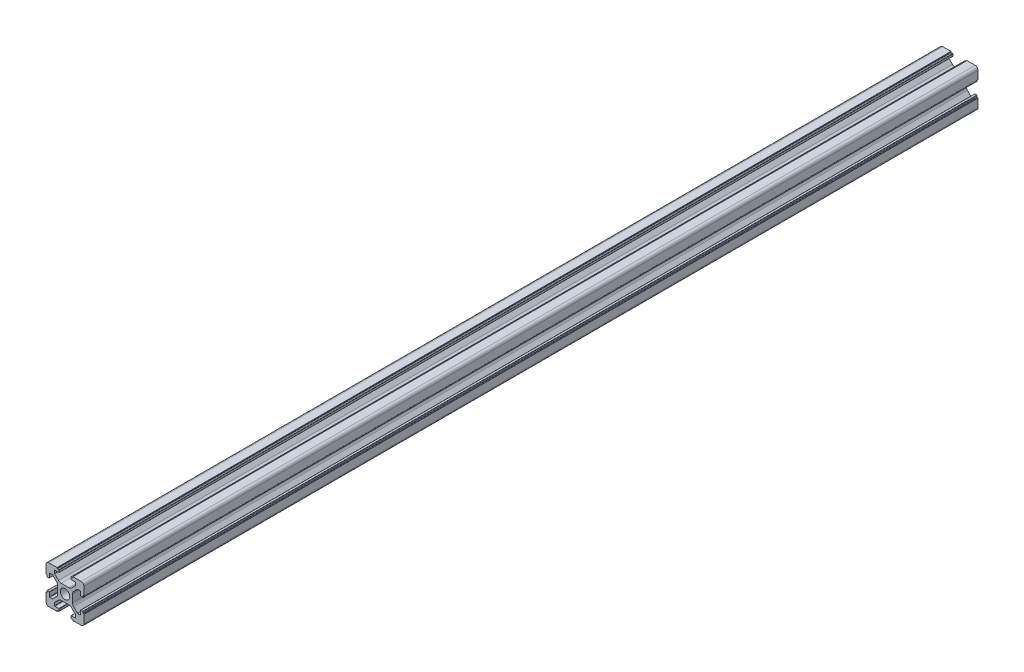
from build123d import *

# Parameters (mm, degrees)
SKETCH1_R           = 2.5
BOSS_EXTRUDE1_DEPTH = 470


with BuildPart() as part:
    # Sketch1 → Boss-Extrude1 (new body)
    with BuildSketch(Plane(origin=(0, 0, 0), x_dir=(1, 0, 0), z_dir=(0, 0, -1))):
        with BuildLine():
            Line((1.5, 0), (5.8, 0))
            ThreePointArc((5.8, 0), (5.870710678, 0.029289322), (5.9, 0.1))
            Line((5.9, 0.1), (5.9, 0.3))
            ThreePointArc((5.9, 0.3), (5.958578644, 0.441421356), (6.1, 0.5))
            Line((6.1, 0.5), (6.7, 0.5))
            ThreePointArc((6.7, 0.5), (6.841421356, 0.558578644), (6.9, 0.7))
            Line((6.9, 0.7), (6.9, 1.6))
            ThreePointArc((6.9, 1.6), (6.841421356, 1.741421356), (6.7, 1.8))
            Line((6.7, 1.8), (4.7, 1.8))
            ThreePointArc((4.7, 1.8), (4.558578644, 1.858578644), (4.5, 2))
            Line((4.5, 2), (4.5, 3.31507576))
            ThreePointArc((4.5, 3.31507576), (4.52283614, 3.429880789), (4.587867966, 3.527207794))
            Line((4.587867966, 3.527207794), (6.574873734, 5.514213562))
            ThreePointArc((6.574873734, 5.514213562), (7.223720432, 5.947759065), (7.989087297, 6.1))
            Line((7.989087297, 6.1), (12.010912703, 6.1))
            ThreePointArc((12.010912703, 6.1), (12.776279568, 5.947759065), (13.425126266, 5.514213562))
            Line((13.425126266, 5.514213562), (15.412132034, 3.527207794))
            ThreePointArc((15.412132034, 3.527207794), (15.47716386, 3.429880789), (15.5, 3.31507576))
            Line((15.5, 3.31507576), (15.5, 2))
            ThreePointArc((15.5, 2), (15.441421356, 1.858578644), (15.3, 1.8))
            Line((15.3, 1.8), (13.3, 1.8))
            ThreePointArc((13.3, 1.8), (13.158578644, 1.741421356), (13.1, 1.6))
            Line((13.1, 1.6), (13.1, 0.7))
            ThreePointArc((13.1, 0.7), (13.158578644, 0.558578644), (13.3, 0.5))
            Line((13.3, 0.5), (13.9, 0.5))
            ThreePointArc((13.9, 0.5), (14.041421356, 0.441421356), (14.1, 0.3))
            Line((14.1, 0.3), (14.1, 0.1))
            ThreePointArc((14.1, 0.1), (14.129289322, 0.029289322), (14.2, 0))
            Line((14.2, 0), (18.5, 0))
            ThreePointArc((18.5, 0), (19.560660172, 0.439339828), (20, 1.5))
            Line((20, 1.5), (20, 5.8))
            ThreePointArc((20, 5.8), (19.970710678, 5.870710678), (19.9, 5.9))
            Line((19.9, 5.9), (19.7, 5.9))
            ThreePointArc((19.7, 5.9), (19.558578644, 5.958578644), (19.5, 6.1))
            Line((19.5, 6.1), (19.5, 6.7))
            ThreePointArc((19.5, 6.7), (19.441421356, 6.841421356), (19.3, 6.9))
            Line((19.3, 6.9), (18.4, 6.9))
            ThreePointArc((18.4, 6.9), (18.258578644, 6.841421356), (18.2, 6.7))
            Line((18.2, 6.7), (18.2, 4.7))
            ThreePointArc((18.2, 4.7), (18.141421356, 4.558578644), (18, 4.5))
            Line((18, 4.5), (16.68492424, 4.5))
            ThreePointArc((16.68492424, 4.5), (16.570119211, 4.52283614), (16.472792206, 4.587867966))
            Line((16.472792206, 4.587867966), (14.485786438, 6.574873734))
            ThreePointArc((14.485786438, 6.574873734), (14.052240935, 7.223720432), (13.9, 7.989087297))
            Line((13.9, 7.989087297), (13.9, 12.010912703))
            ThreePointArc((13.9, 12.010912703), (14.052240935, 12.776279568), (14.485786438, 13.425126266))
            Line((14.485786438, 13.425126266), (16.472792206, 15.412132034))
            ThreePointArc((16.472792206, 15.412132034), (16.570119211, 15.47716386), (16.68492424, 15.5))
            Line((16.68492424, 15.5), (18, 15.5))
            ThreePointArc((18, 15.5), (18.141421356, 15.441421356), (18.2, 15.3))
            Line((18.2, 15.3), (18.2, 13.3))
            ThreePointArc((18.2, 13.3), (18.258578644, 13.158578644), (18.4, 13.1))
            Line((18.4, 13.1), (19.3, 13.1))
            ThreePointArc((19.3, 13.1), (19.441421356, 13.158578644), (19.5, 13.3))
            Line((19.5, 13.3), (19.5, 13.9))
            ThreePointArc((19.5, 13.9), (19.558578644, 14.041421356), (19.7, 14.1))
            Line((19.7, 14.1), (19.9, 14.1))
            ThreePointArc((19.9, 14.1), (19.970710678, 14.129289322), (20, 14.2))
            Line((20, 14.2), (20, 18.5))
            ThreePointArc((20, 18.5), (19.560660172, 19.560660172), (18.5, 20))
            Line((18.5, 20), (14.2, 20))
            ThreePointArc((14.2, 20), (14.129289322, 19.970710678), (14.1, 19.9))
            Line((14.1, 19.9), (14.1, 19.7))
            ThreePointArc((14.1, 19.7), (14.041421356, 19.558578644), (13.9, 19.5))
            Line((13.9, 19.5), (13.3, 19.5))
            ThreePointArc((13.3, 19.5), (13.158578644, 19.441421356), (13.1, 19.3))
            Line((13.1, 19.3), (13.1, 18.4))
            ThreePointArc((13.1, 18.4), (13.158578644, 18.258578644), (13.3, 18.2))
            Line((13.3, 18.2), (15.3, 18.2))
            ThreePointArc((15.3, 18.2), (15.441421356, 18.141421356), (15.5, 18))
            Line((15.5, 18), (15.5, 16.68492424))
            ThreePointArc((15.5, 16.68492424), (15.47716386, 16.570119211), (15.412132034, 16.472792206))
            Line((15.412132034, 16.472792206), (13.425126266, 14.485786438))
            ThreePointArc((13.425126266, 14.485786438), (12.776279568, 14.052240935), (12.010912703, 13.9))
            Line((12.010912703, 13.9), (7.989087297, 13.9))
            ThreePointArc((7.989087297, 13.9), (7.223720432, 14.052240935), (6.574873734, 14.485786438))
            Line((6.574873734, 14.485786438), (4.587867966, 16.472792206))
            ThreePointArc((4.587867966, 16.472792206), (4.52283614, 16.570119211), (4.5, 16.68492424))
            Line((4.5, 16.68492424), (4.5, 18))
            ThreePointArc((4.5, 18), (4.558578644, 18.141421356), (4.7, 18.2))
            Line((4.7, 18.2), (6.7, 18.2))
            ThreePointArc((6.7, 18.2), (6.841421356, 18.258578644), (6.9, 18.4))
            Line((6.9, 18.4), (6.9, 19.3))
            ThreePointArc((6.9, 19.3), (6.841421356, 19.441421356), (6.7, 19.5))
            Line((6.7, 19.5), (6.1, 19.5))
            ThreePointArc((6.1, 19.5), (5.958578644, 19.558578644), (5.9, 19.7))
            Line((5.9, 19.7), (5.9, 19.9))
            ThreePointArc((5.9, 19.9), (5.870710678, 19.970710678), (5.8, 20))
            Line((5.8, 20), (1.5, 20))
            ThreePointArc((1.5, 20), (0.439339828, 19.560660172), (0, 18.5))
            Line((0, 18.5), (0, 14.2))
            ThreePointArc((0, 14.2), (0.029289322, 14.129289322), (0.1, 14.1))
            Line((0.1, 14.1), (0.3, 14.1))
            ThreePointArc((0.3, 14.1), (0.441421356, 14.041421356), (0.5, 13.9))
            Line((0.5, 13.9), (0.5, 13.3))
            ThreePointArc((0.5, 13.3), (0.558578644, 13.158578644), (0.7, 13.1))
            Line((0.7, 13.1), (1.6, 13.1))
            ThreePointArc((1.6, 13.1), (1.741421356, 13.158578644), (1.8, 13.3))
            Line((1.8, 13.3), (1.8, 15.3))
            ThreePointArc((1.8, 15.3), (1.858578644, 15.441421356), (2, 15.5))
            Line((2, 15.5), (3.31507576, 15.5))
            ThreePointArc((3.31507576, 15.5), (3.429880789, 15.47716386), (3.527207794, 15.412132034))
            Line((3.527207794, 15.412132034), (5.514213562, 13.425126266))
            ThreePointArc((5.514213562, 13.425126266), (5.947759065, 12.776279568), (6.1, 12.010912703))
            Line((6.1, 12.010912703), (6.1, 7.989087297))
            ThreePointArc((6.1, 7.989087297), (5.947759065, 7.223720432), (5.514213562, 6.574873734))
            Line((5.514213562, 6.574873734), (3.527207794, 4.587867966))
            ThreePointArc((3.527207794, 4.587867966), (3.429880789, 4.52283614), (3.31507576, 4.5))
            Line((3.31507576, 4.5), (2, 4.5))
            ThreePointArc((2, 4.5), (1.858578644, 4.558578644), (1.8, 4.7))
            Line((1.8, 4.7), (1.8, 6.7))
            ThreePointArc((1.8, 6.7), (1.741421356, 6.841421356), (1.6, 6.9))
            Line((1.6, 6.9), (0.7, 6.9))
            ThreePointArc((0.7, 6.9), (0.558578644, 6.841421356), (0.5, 6.7))
            Line((0.5, 6.7), (0.5, 6.1))
            ThreePointArc((0.5, 6.1), (0.441421356, 5.958578644), (0.3, 5.9))
            Line((0.3, 5.9), (0.1, 5.9))
            ThreePointArc((0.1, 5.9), (0.029289322, 5.870710678), (0, 5.8))
            Line((0, 5.8), (0, 1.5))
            ThreePointArc((0, 1.5), (0.439339828, 0.439339828), (1.5, 0))
        make_face()
        with Locations((10, 10)):
            Circle(SKETCH1_R, mode=Mode.SUBTRACT)
    extrude(amount=BOSS_EXTRUDE1_DEPTH)


solid = part.part
